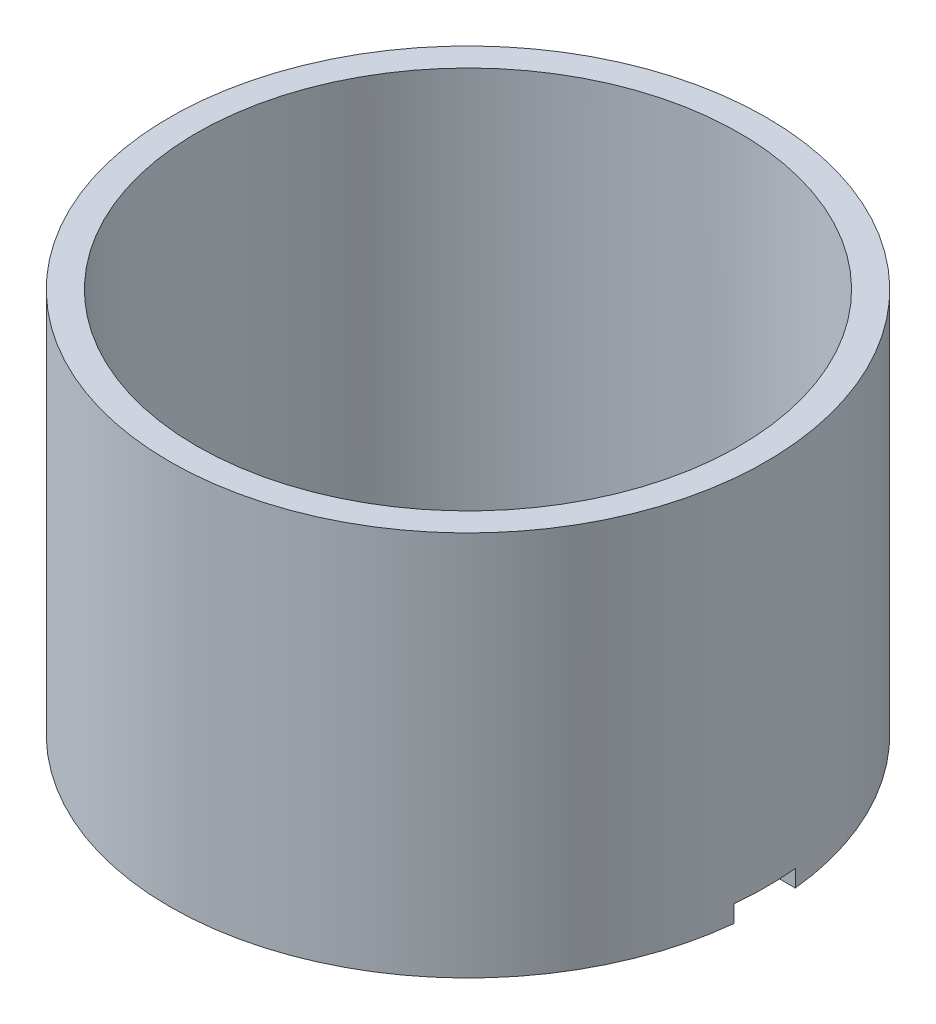
from build123d import *

# Parameters (mm, degrees)
BOSS_EXTRUDE1_DEPTH      = 12.97
BOSS_EXTRUDE1_DEPTH_BACK = 0.6
SKETCH1_R                = 10.5
SKETCH1_R_2              = 9.55
CUT_EXTRUDE1_DEPTH       = 20.716006188
CUT_EXTRUDE1_DEPTH_BACK  = 20.716006188
SKETCH2_W                = 2.16
SKETCH2_H                = 0.617422303


with BuildPart() as part:
    # Sketch1 → Boss-Extrude1 (new, two sides: drawn at the far end of the back side and taken through both)
    with BuildSketch(Plane(origin=(0, 0, 0), x_dir=(1, 0, 0), z_dir=(0, 1, 0)).offset(-BOSS_EXTRUDE1_DEPTH_BACK)):
        with Locations(Location((0, 0, 0), (0, 0, 270))):
            Circle(SKETCH1_R)
        with Locations(Location((0, 0, 0), (0, 0, 270))):
            Circle(SKETCH1_R_2, mode=Mode.SUBTRACT)
    extrude(amount=BOSS_EXTRUDE1_DEPTH + BOSS_EXTRUDE1_DEPTH_BACK)

    # Sketch2 → Cut-Extrude1 (cut, two sides: drawn at the far end of the back side and taken through both)
    with BuildSketch(Plane(origin=(0, 0, 0), x_dir=(0, 0, -1), z_dir=(1, 0, 0)).offset(-CUT_EXTRUDE1_DEPTH_BACK)):
        with Locations((0, -0.308711152)):
            Rectangle(SKETCH2_W, SKETCH2_H)
    extrude(amount=CUT_EXTRUDE1_DEPTH + CUT_EXTRUDE1_DEPTH_BACK, mode=Mode.SUBTRACT)


solid = part.part
